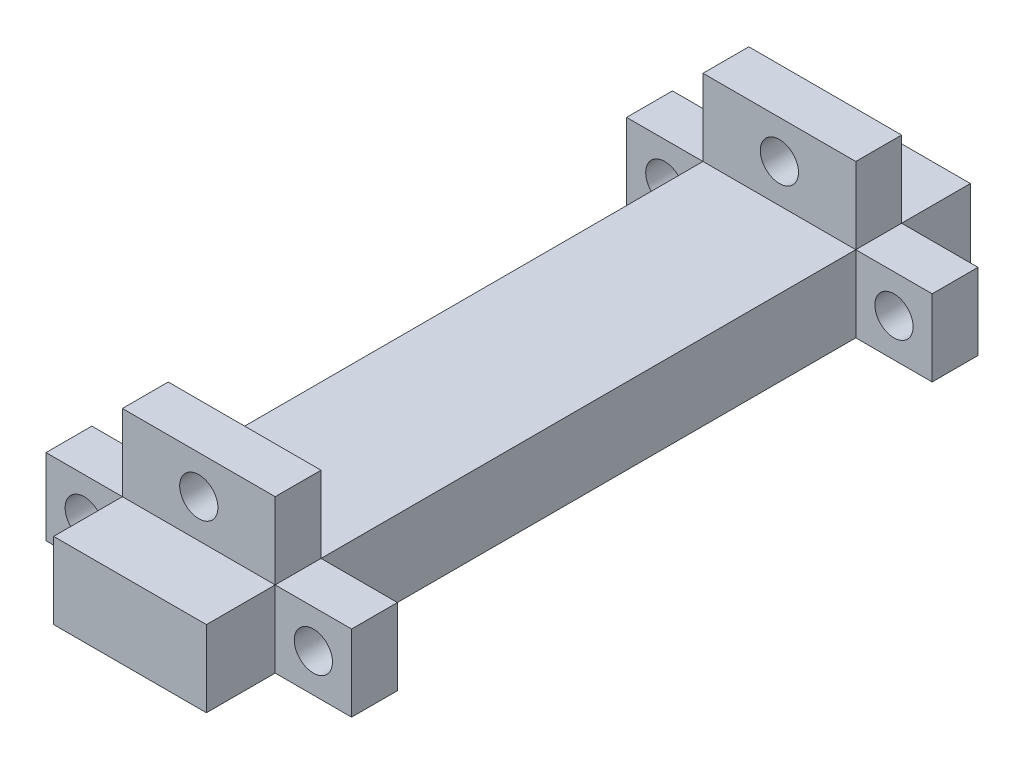
from build123d import *

# Parameters (mm, degrees)
SKETCH_1_W               = 20
SKETCH_1_H               = 10
EXTRUDE_1_DEPTH          = 100
EXTRUDE_START            = -9
SKETCH_2_W               = 10
SKETCH_2_H               = 10
SKETCH_2_W_2             = 20
EXTRUDE_2_DEPTH          = 6
CUT_EXTRUDE_1_DEPTH      = 98.88258272
CUT_EXTRUDE_1_DEPTH_BACK = 98.88258272
SKETCH_3_R               = 2.5


with BuildPart() as part:
    # 草图1 → 凸台-拉伸1 (new body)
    with BuildSketch(Plane.XY):
        with Locations((10, 5)):
            Rectangle(SKETCH_1_W, SKETCH_1_H)
    extrude(amount=EXTRUDE_1_DEPTH)

    # 草图2 → 凸台-拉伸2 (add)
    with BuildSketch(Plane(origin=(0, 0, 0), x_dir=(-1, 0, 0), z_dir=(0, 0, -1)).offset(EXTRUDE_START)):
        with Locations((-25, 5)):
            Rectangle(SKETCH_2_W, SKETCH_2_H)
        with Locations((-10, 15)):
            Rectangle(SKETCH_2_W_2, SKETCH_2_H)
        with Locations((5, 5)):
            Rectangle(SKETCH_2_W, SKETCH_2_H)
    extrude_2 = extrude(amount=-EXTRUDE_2_DEPTH)

    # 镜向1: 凸台-拉伸2 across plane
    add(extrude_2.mirror(Plane(origin=(0, 0, 50), x_dir=(1, 0, 0), z_dir=(0, 0, -1))))

    # 草图3 → 切除-拉伸1 (cut, two sides: drawn at the far end of the back side and taken through both)
    with BuildSketch(Plane(origin=(0, 0, 9), x_dir=(-1, 0, 0), z_dir=(0, 0, -1)).offset(-CUT_EXTRUDE_1_DEPTH_BACK)):
        with Locations(Location((5, 5, 0), (0, 0, 180))):
            Circle(SKETCH_3_R)
        with Locations(Location((-10, 15, 0), (0, 0, 180))):
            Circle(SKETCH_3_R)
        with Locations(Location((-25, 5, 0), (0, 0, 180))):
            Circle(SKETCH_3_R)
    extrude(amount=CUT_EXTRUDE_1_DEPTH + CUT_EXTRUDE_1_DEPTH_BACK, mode=Mode.SUBTRACT)


solid = part.part
